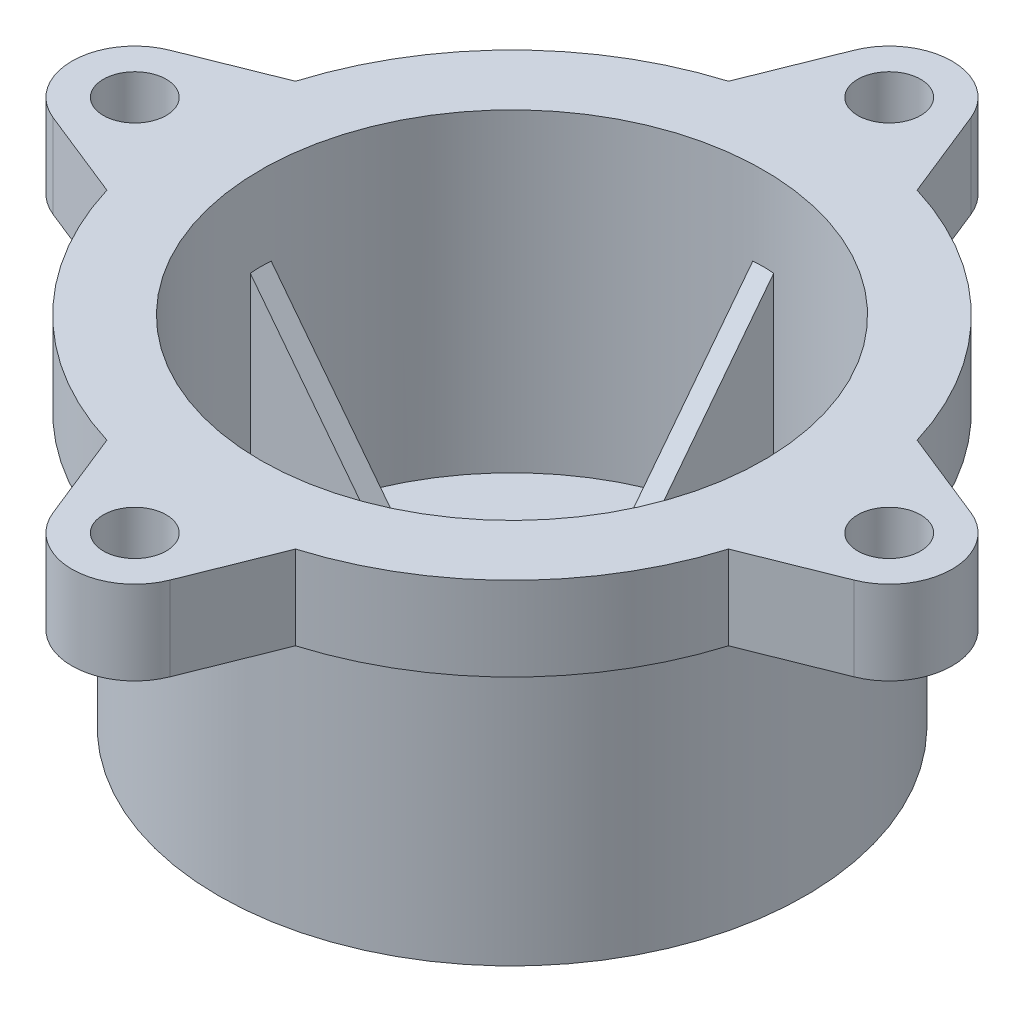
from build123d import *
from build123d.topology import SkipClean

# Parameters (mm, degrees)
SKETCH1_R           = 15.5
SKETCH1_R_2         = 12
BOSS_EXTRUDE1_DEPTH = 4
BOSS_EXTRUDE2_START = 13
SKETCH2_R           = 14
SKETCH2_R_2         = 12
BOSS_EXTRUDE2_DEPTH = 13
BOSS_EXTRUDE3_DEPTH = 0.5
CIRPATTERN1_COUNT   = 4
BOSS_EXTRUDE4_START = -4
SKETCH4_R           = 1.5
BOSS_EXTRUDE4_DEPTH = 4
CIRPATTERN2_COUNT   = 4
SKETCH5_R           = 12
BOSS_EXTRUDE5_DEPTH = 2


with BuildPart() as part:
    # Sketch1 → Boss-Extrude1 (new body)
    with BuildSketch(Plane(origin=(0, 0, 0), x_dir=(1, 0, 0), z_dir=(0, 1, 0))):
        with Locations(Location((0, 0, 0), (0, 0, 270))):
            Circle(SKETCH1_R)
        with Locations(Location((0, 0, 0), (0, 0, 270))):
            Circle(SKETCH1_R_2, mode=Mode.SUBTRACT)
    extrude(amount=BOSS_EXTRUDE1_DEPTH)

    # Sketch2 → Boss-Extrude2 (add)
    with SkipClean():  # the faces are left unmerged after this step: merging them gives an invalid solid
        with BuildSketch(Plane.XZ.offset(BOSS_EXTRUDE2_START)):
            with Locations(Location((0, 0, 0), (0, 0, 90))):
                Circle(SKETCH2_R)
            with Locations(Location((0, 0, 0), (0, 0, 270))):
                Circle(SKETCH2_R_2, mode=Mode.SUBTRACT)
        extrude(amount=-BOSS_EXTRUDE2_DEPTH)

    # Sketch3 → Boss-Extrude3 (add, symmetric)
    with SkipClean():  # the faces are left unmerged after this step: merging them gives an invalid solid
        with BuildSketch(Plane(origin=(0, 0, 0), x_dir=(0, 0, -1), z_dir=(1, 0, 0))):
            Polygon((-12, 0), (-3.5, -11), (3.5, -11), (12, 0), (12, -13), (-12, -13), align=None)
        boss_extrude3 = extrude(amount=BOSS_EXTRUDE3_DEPTH, both=True)

    # CirPattern1: Boss-Extrude3 ×4 about axis
    with SkipClean():  # the faces are left unmerged after this step: merging them gives an invalid solid
        cirpattern1_axis = Axis((0, 0, 0), (0, 1, 0))
        for i in range(1, CIRPATTERN1_COUNT):
            add(boss_extrude3.rotate(cirpattern1_axis, i * 360 / CIRPATTERN1_COUNT))

    # Sketch4 → Boss-Extrude4 (add)
    with SkipClean():  # the faces are left unmerged after this step: merging them gives an invalid solid
        with BuildSketch(Plane(origin=(0, 4, 0), x_dir=(1, 0, 0), z_dir=(0, 1, 0)).offset(BOSS_EXTRUDE4_START)):
            with BuildLine():
                Line((-2.785012774, 19.115214709), (-4.5, 14.832396974))
                ThreePointArc((-4.5, 14.832396974), (0, 15.5), (4.5, 14.832396974))
                Line((4.5, 14.832396974), (2.785012774, 19.115214709))
                ThreePointArc((2.785012774, 19.115214709), (0, 21), (-2.785012774, 19.115214709))
            make_face()
            with Locations(Location((0, 18, 0), (0, 0, 270))):
                Circle(SKETCH4_R, mode=Mode.SUBTRACT)
        boss_extrude4 = extrude(amount=BOSS_EXTRUDE4_DEPTH)

    # CirPattern2: Boss-Extrude4 ×4 about axis
    with SkipClean():  # the faces are left unmerged after this step: merging them gives an invalid solid
        cirpattern2_axis = Axis((0, 0, 0), (0, 1, 0))
        for i in range(1, CIRPATTERN2_COUNT):
            add(boss_extrude4.rotate(cirpattern2_axis, i * 360 / CIRPATTERN2_COUNT))

    # Sketch5 → Boss-Extrude5 (add)
    with SkipClean():  # the faces are left unmerged after this step: merging them gives an invalid solid
        with BuildSketch(Plane.XZ.offset(13)):
            with Locations(Location((0, 0, 0), (0, 0, 267.611984537))):
                Circle(SKETCH5_R)
        extrude(amount=-BOSS_EXTRUDE5_DEPTH)


solid = part.part
